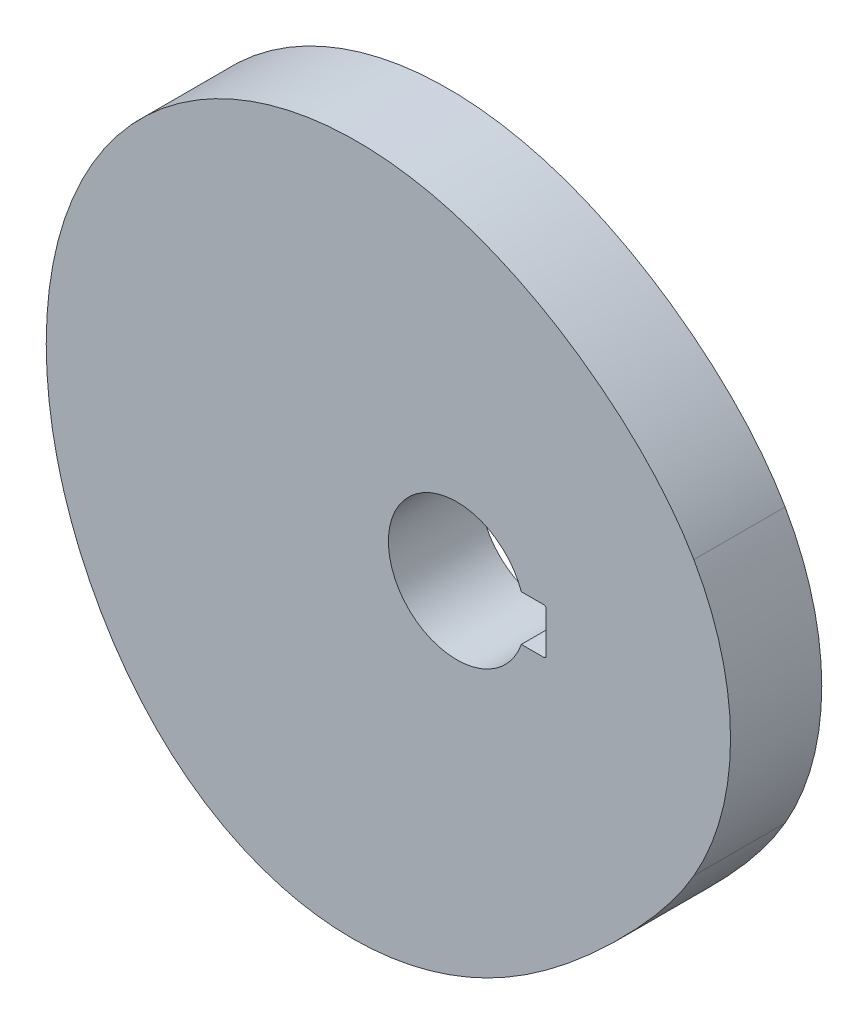
from build123d import *

# Parameters (mm, degrees)
BOSS_EXTRUDE1_DEPTH            = 5
CUT_EXTRUDE2_REACH             = 105.073
SKETCH2_R                      = 7.5
CUT_EXTRUDE2_DIRECTION_2_REACH = 105.073
CUT_EXTRUDE3_REACH             = 105.073
SKETCH3_W                      = 2.728932188
SKETCH3_H                      = 5
CUT_EXTRUDE3_DIRECTION_2_REACH = 105.073
FILLET1_R                      = 0.25


with BuildPart() as part:
    # Cam Profile Sketch → Boss-Extrude1 (new, symmetric)
    with BuildSketch(Plane.XY):
        with BuildLine():
            ThreePointArc((-95, 0), (-93.466662183, -11.64685703), (-88.97114317, -22.5))
            add(Edge.make_bspline(
                [(-24.019237886, -15), (-24.057726996, -15.066665093), (-24.135542603, -15.199984179), (-24.294210245, -15.468284804), (-24.486367794, -15.783992161), (-24.675050968, -16.085484944), (-24.8709034, -16.391428035), (-25.070085707, -16.695400658), (-25.371964938, -17.145687962), (-25.732401665, -17.664420975), (-26.25998012, -18.393991283), (-26.860454757, -19.180499871), (-27.42063933, -19.883348998), (-28.224273383, -20.853609638), (-28.932471155, -21.671343711), (-29.778521208, -22.611364699), (-30.768740875, -23.66727202), (-31.65162684, -24.579405423), (-32.935753353, -25.859926354), (-34.511627336, -27.360899541), (-36.401054833, -29.057445052), (-38.638036886, -30.906683495), (-40.962685031, -32.645088961), (-43.383053705, -34.248371754), (-45.959016936, -35.723391452), (-48.63808706, -37.003330144), (-51.412600635, -38.062115797), (-54.268660613, -38.876057715), (-57.122562395, -39.420836577), (-60.014975318, -39.698800922), (-62.92095712, -39.698748169), (-65.813153516, -39.414329857), (-68.733508438, -38.830455347), (-71.647577447, -37.928108287), (-74.516760762, -36.695099337), (-77.300501066, -35.127967674), (-79.581058345, -33.512324426), (-81.413170087, -31.971920034), (-82.710461133, -30.732394546), (-83.542718688, -29.87350859), (-84.214382827, -29.137329667), (-84.738529492, -28.536655846), (-85.245699359, -27.929262329), (-85.736176294, -27.316005605), (-86.328070579, -26.54398124), (-86.895689897, -25.761539987), (-87.388541821, -25.043964898), (-87.812126944, -24.397637278), (-88.0727685, -23.98897293), (-88.277415015, -23.661731501), (-88.47549914, -23.338928267), (-88.682364544, -22.994067163), (-88.846740598, -22.714364006), (-88.930106702, -22.571077248), (-88.97114317, -22.5)],
                knots=[0.066100625, 0.066100625, 0.066100625, 0.066100625, 0.066100625, 0.069918368, 0.07373611, 0.077553853, 0.081371596, 0.085189338, 0.089007081, 0.092824823, 0.104210915, 0.111779263, 0.126915961, 0.13448431, 0.142052658, 0.164824841, 0.172460326, 0.187731296, 0.203002265, 0.218273235, 0.248815158, 0.279357081, 0.309899022, 0.340440963, 0.3709829, 0.401524836, 0.434787958, 0.465329966, 0.495871896, 0.526413881, 0.556955827, 0.587497796, 0.618039752, 0.648581738, 0.682146995, 0.715712289, 0.749277564, 0.782842858, 0.799625499, 0.816408139, 0.82479946, 0.833190781, 0.841582102, 0.849973423, 0.858114254, 0.866255085, 0.882536748, 0.890677579, 0.894747995, 0.89881841, 0.902888826, 0.906959242, 0.911029657, 0.915100073, 0.915100073, 0.915100073, 0.915100073, 0.915100073], degree=4))
            ThreePointArc((-24.019237886, -15), (-20, 0), (-24.019237887, 15))
            add(Edge.make_bspline(
                [(-24.019237887, 15), (-24.068311179, 15.084997436), (-24.167781709, 15.254906705), (-24.372716614, 15.599220619), (-24.61865228, 15.997095978), (-24.863655112, 16.379697363), (-25.119128687, 16.767025959), (-25.379779341, 17.150163728), (-25.645266211, 17.528771772), (-25.945604472, 17.944852126), (-26.282522616, 18.396747851), (-26.657891266, 18.882728432), (-27.073733427, 19.401098012), (-27.605052795, 20.039628028), (-28.260315658, 20.790892876), (-29.137432462, 21.741660802), (-30.256936541, 22.871106034), (-31.513445882, 24.046837605), (-32.913450459, 25.258032474), (-34.702854921, 26.693691652), (-36.916722417, 28.304317086), (-39.592318083, 30.026272793), (-42.770642978, 31.770153659), (-46.070459158, 33.272672468), (-49.480743686, 34.50579862), (-53.151070656, 35.484877681), (-56.901056915, 36.10189034), (-60.695503134, 36.328853465), (-64.491489782, 36.145677899), (-68.078081084, 35.592442903), (-71.584996355, 34.657928649), (-74.969324852, 33.346617401), (-78.188701421, 31.670427503), (-81.216628819, 29.639247685), (-84.012954659, 27.273762593), (-86.22395529, 24.936788464), (-88.220215395, 22.396629412), (-89.728420053, 20.074270167), (-90.845118378, 18.05504037), (-91.819116647, 15.964820644), (-92.485619066, 14.320524673), (-92.985254722, 12.89744926), (-93.352941131, 11.710925817), (-93.616328574, 10.770894801), (-93.811723307, 10.014627811), (-94.03690859, 9.064875481), (-94.244035537, 8.074310703), (-94.430306675, 7.044765066), (-94.592927417, 5.974011134), (-94.710991165, 5.06120396), (-94.808756512, 4.141198889), (-94.886451771, 3.228074895), (-94.944318966, 2.297668795), (-94.977825799, 1.506610134), (-94.994478369, 0.807430389), (-94.999212886, 0.295654949), (-95, 0.0977871), (-95, 0)],
                knots=[0.066673701, 0.066673701, 0.066673701, 0.066673701, 0.066673701, 0.070604246, 0.074534791, 0.078465336, 0.082395881, 0.086326425, 0.09025697, 0.094187515, 0.09811806, 0.103762991, 0.109407922, 0.115052853, 0.120697784, 0.131987646, 0.143277509, 0.158999688, 0.174721868, 0.190444047, 0.206166227, 0.236936319, 0.267706411, 0.298476509, 0.329246606, 0.360016733, 0.390786859, 0.427383219, 0.45815328, 0.48892347, 0.519693606, 0.550463754, 0.581233829, 0.612004014, 0.642774165, 0.674103327, 0.705432525, 0.721097132, 0.752426343, 0.768090947, 0.783755547, 0.799420146, 0.81268856, 0.819322767, 0.825956974, 0.832591181, 0.839225388, 0.852493803, 0.860326099, 0.868158396, 0.875990693, 0.883822989, 0.891655286, 0.899487583, 0.90731988, 0.911236028, 0.915152176, 0.915152176, 0.915152176, 0.915152176, 0.915152176], degree=4))
        make_face()
    extrude(amount=BOSS_EXTRUDE1_DEPTH, both=True)

    # Sketch2 → Cut-Extrude2 (cut, up to next)
    with BuildSketch(Plane.XY, mode=Mode.PRIVATE) as cut_extrude2_sk1:
        with Locations((-50, 0)):
            Circle(SKETCH2_R)
    cut_extrude2_tool1 = extrude(cut_extrude2_sk1.sketch, amount=-CUT_EXTRUDE2_REACH, mode=Mode.PRIVATE) & part.part
    add(cut_extrude2_tool1.solids().sort_by_distance((-50, 0, 0))[0], mode=Mode.SUBTRACT)

    # Sketch2 → Cut-Extrude2 direction 2 (cut, up to next)
    with BuildSketch(Plane.XY, mode=Mode.PRIVATE) as cut_extrude2_direction_2_sk1:
        with Locations((-50, 0)):
            Circle(SKETCH2_R)
    cut_extrude2_direction_2_tool1 = extrude(cut_extrude2_direction_2_sk1.sketch, amount=CUT_EXTRUDE2_DIRECTION_2_REACH, mode=Mode.PRIVATE) & part.part
    add(cut_extrude2_direction_2_tool1.solids().sort_by_distance((-50, 0, 0))[0], mode=Mode.SUBTRACT)

    # Sketch3 → Cut-Extrude3 (cut, up to next)
    with BuildSketch(Plane.XY, mode=Mode.PRIVATE) as cut_extrude3_sk1:
        with Locations((-41.564466094, 0)):
            Rectangle(SKETCH3_W, SKETCH3_H)
    cut_extrude3_tool1 = extrude(cut_extrude3_sk1.sketch, amount=-CUT_EXTRUDE3_REACH, mode=Mode.PRIVATE) & part.part
    add(cut_extrude3_tool1.solids().sort_by_distance((-41.564466, 0, 0))[0], mode=Mode.SUBTRACT)

    # Sketch3 → Cut-Extrude3 direction 2 (cut, up to next)
    with BuildSketch(Plane.XY, mode=Mode.PRIVATE) as cut_extrude3_direction_2_sk1:
        with Locations((-41.564466094, 0)):
            Rectangle(SKETCH3_W, SKETCH3_H)
    cut_extrude3_direction_2_tool1 = extrude(cut_extrude3_direction_2_sk1.sketch, amount=CUT_EXTRUDE3_DIRECTION_2_REACH, mode=Mode.PRIVATE) & part.part
    add(cut_extrude3_direction_2_tool1.solids().sort_by_distance((-41.564466, 0, 0))[0], mode=Mode.SUBTRACT)

    # Fillet1
    fillet1_edges = [part.edges().sort_by_distance(p)[0] for p in [
        (-40.2, -2.5, 0),
        (-40.2, 2.5, 0),
    ]]
    fillet(fillet1_edges, radius=FILLET1_R)


solid = part.part
